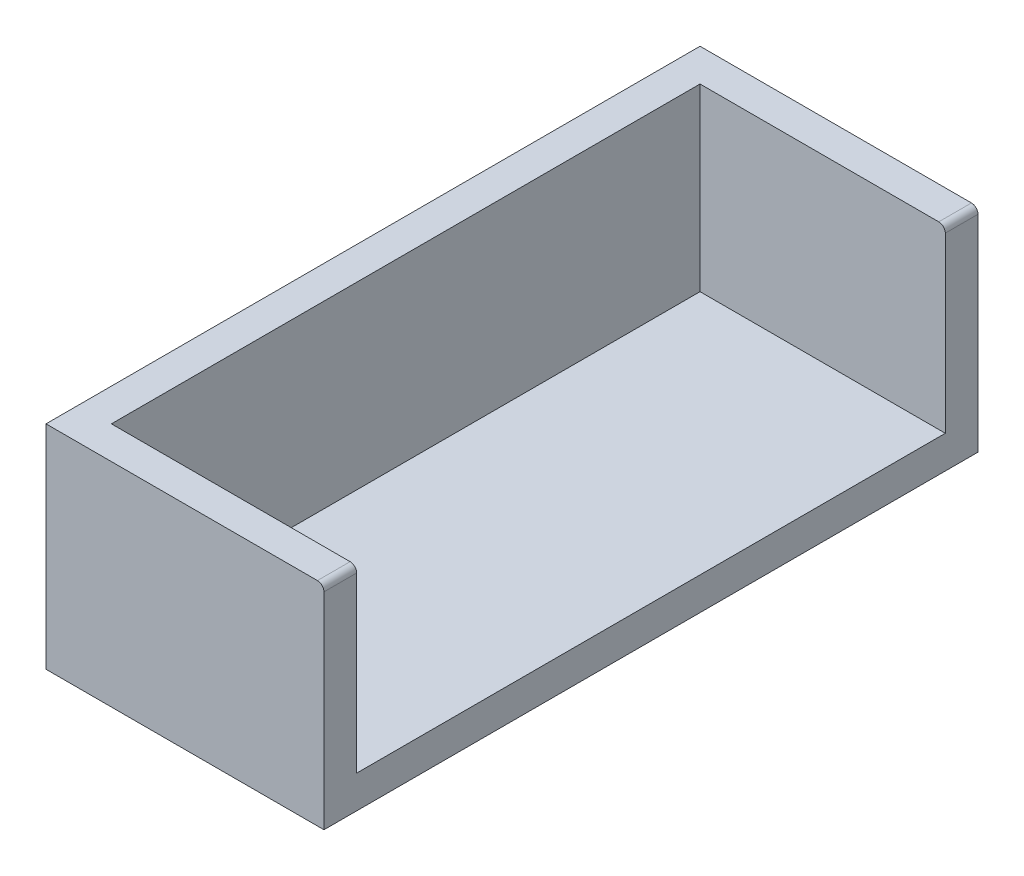
from build123d import *

# Parameters (mm, degrees)
BOSS_EXTRUDE1_DEPTH = 2000
SKETCH2_W           = 1015.39839311
SKETCH2_H           = 1800
CUT_EXTRUDE1_DEPTH  = 550
SKETCH3_R           = 40
BOSS_EXTRUDE2_DEPTH = 20


with BuildPart() as part:
    # Sketch1 → Boss-Extrude1 (new body)
    with BuildSketch(Plane.XY):
        with BuildLine():
            Line((0, 0), (850, 0))
            Line((850, 0), (850, 630))
            ThreePointArc((850, 630), (844.142135624, 644.142135624), (830, 650))
            Line((830, 650), (0, 650))
            Line((0, 650), (0, 0))
        make_face()
    extrude(amount=BOSS_EXTRUDE1_DEPTH)

    # Sketch2 → Cut-Extrude1 (cut)
    with BuildSketch(Plane(origin=(0, 650, 0), x_dir=(1, 0, 0), z_dir=(0, 1, 0))):
        with Locations((607.699196555, -1000)):
            Rectangle(SKETCH2_W, SKETCH2_H)
    extrude(amount=-CUT_EXTRUDE1_DEPTH, mode=Mode.SUBTRACT)

    # Sketch3 → Boss-Extrude2 (add)
    with BuildSketch(Plane.XZ):
        with Locations(Location((150, 1850, 0), (0, 0, 90))):
            Circle(SKETCH3_R)
        with Locations(Location((700, 1850, 0), (0, 0, 90))):
            Circle(SKETCH3_R)
        with Locations(Location((700, 150, 0), (0, 0, 90))):
            Circle(SKETCH3_R)
        with Locations(Location((150, 150, 0), (0, 0, 90))):
            Circle(SKETCH3_R)
    extrude(amount=BOSS_EXTRUDE2_DEPTH)


solid = part.part
